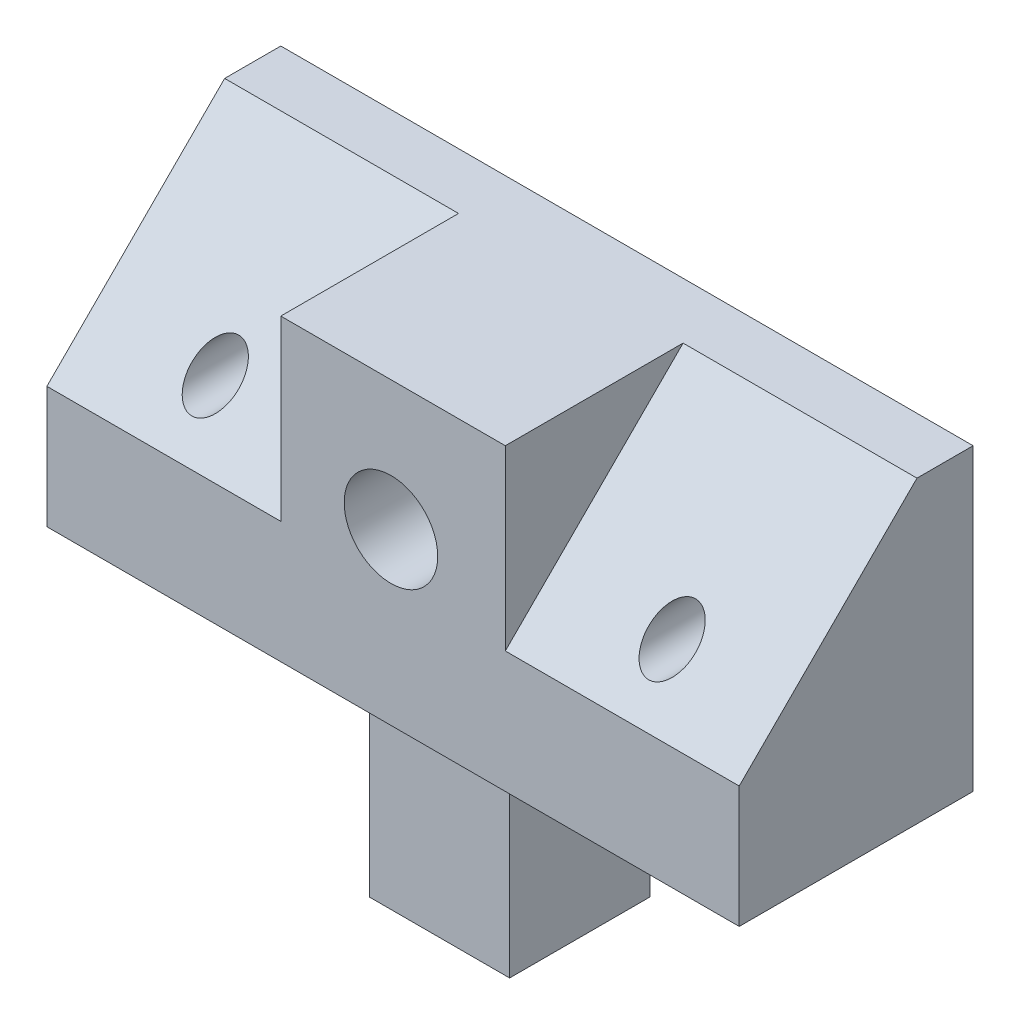
from build123d import *

# Parameters (mm, degrees)
SKETCH2_W           = 74
SKETCH2_H           = 32
BOSS_EXTRUDE1_DEPTH = 25
CUT_EXTRUDE2_DEPTH  = 25
CUT_EXTRUDE3_DEPTH  = 25
SKETCH6_R           = 5
SKETCH6_R_2         = 2.5
CUT_EXTRUDE4_DEPTH  = 33
SKETCH7_W           = 15
SKETCH7_H           = 15
BOSS_EXTRUDE2_DEPTH = 22


with BuildPart() as part:
    # Sketch2 → Boss-Extrude1 (new body)
    with BuildSketch(Plane.XY):
        with Locations((37, 16)):
            Rectangle(SKETCH2_W, SKETCH2_H)
    extrude(amount=BOSS_EXTRUDE1_DEPTH)

    # Sketch4 → Cut-Extrude2 (cut)
    with BuildSketch(Plane.ZY):
        Polygon((25, 32), (6, 32), (25, 13), align=None)
    extrude(amount=-CUT_EXTRUDE2_DEPTH, mode=Mode.SUBTRACT)

    # Sketch5 → Cut-Extrude3 (cut)
    with BuildSketch(Plane(origin=(74, 0, 0), x_dir=(0, 0, -1), z_dir=(1, 0, 0))):
        Polygon((-25, 32), (-6, 32), (-25, 13), align=None)
    extrude(amount=-CUT_EXTRUDE3_DEPTH, mode=Mode.SUBTRACT)

    # Sketch6 → Cut-Extrude4 (cut)
    with BuildSketch(Plane.XY.offset(25)):
        with Locations((36.775112994, 18.136426558)):
            Circle(SKETCH6_R)
        with Locations(Location((13, 18, 0), (0, 0, 270))):
            Circle(SKETCH6_R_2)
        with Locations(Location((61.830812036, 18, 0), (0, 0, 270))):
            Circle(SKETCH6_R_2)
    extrude(amount=-CUT_EXTRUDE4_DEPTH, mode=Mode.SUBTRACT)

    # Sketch7 → Boss-Extrude2 (add)
    with BuildSketch(Plane.XZ):
        with Locations((37, 12.541396218)):
            Rectangle(SKETCH7_W, SKETCH7_H)
    extrude(amount=BOSS_EXTRUDE2_DEPTH)


solid = part.part
